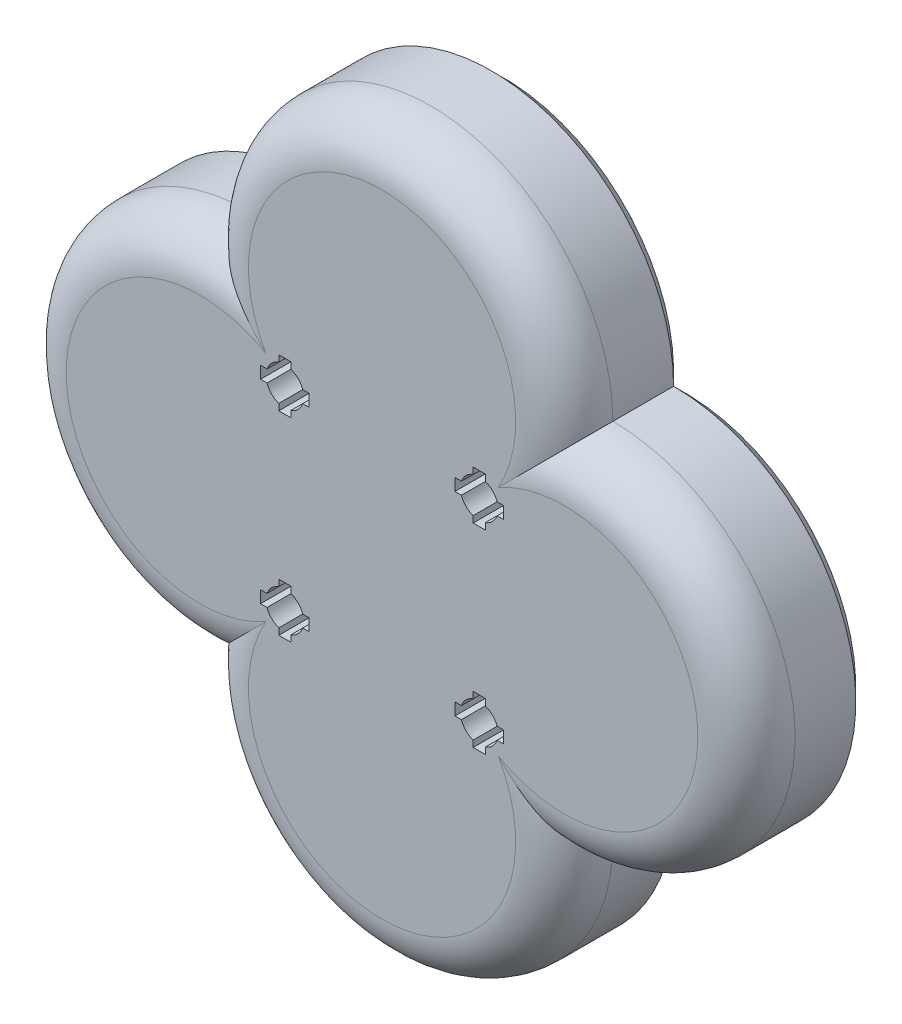
from build123d import *

# Parameters (mm, degrees)
BOSS_EXTRUDE1_DEPTH = 10
FILLET1_R           = 4
CHAMFER1_SIZE       = 1


with BuildPart() as part:
    # Sketch1 → Boss-Extrude1 (new body)
    with BuildSketch(Plane.XY):
        with BuildLine():
            ThreePointArc((-7, 7), (8, 22), (23, 7))
            ThreePointArc((23, 7), (38, -8), (23, -23))
            ThreePointArc((23, -23), (8, -38), (-7, -23))
            ThreePointArc((-7, -23), (-22, -8), (-7, 7))
        make_face()
        with BuildLine():
            Line((-0.5, -2), (0.5, -2))
            Line((0.5, -2), (0.5, -1.467140075))
            ThreePointArc((0.5, -1.467140075), (1.096015511, -1.096015511), (1.467140075, -0.5))
            Line((1.467140075, -0.5), (2, -0.5))
            Line((2, -0.5), (2, 0.5))
            Line((2, 0.5), (1.467140075, 0.5))
            ThreePointArc((1.467140075, 0.5), (1.096015511, 1.096015511), (0.5, 1.467140075))
            Line((0.5, 1.467140075), (0.5, 2))
            Line((0.5, 2), (-0.5, 2))
            Line((-0.5, 2), (-0.5, 1.467140075))
            ThreePointArc((-0.5, 1.467140075), (-1.096015511, 1.096015511), (-1.467140075, 0.5))
            Line((-1.467140075, 0.5), (-2, 0.5))
            Line((-2, 0.5), (-2, -0.5))
            Line((-2, -0.5), (-1.467140075, -0.5))
            ThreePointArc((-1.467140075, -0.5), (-1.096015511, -1.096015511), (-0.5, -1.467140075))
            Line((-0.5, -1.467140075), (-0.5, -2))
        make_face(mode=Mode.SUBTRACT)
        with BuildLine():
            Line((18, -0.5), (18, 0.5))
            Line((18, 0.5), (17.467140075, 0.5))
            ThreePointArc((17.467140075, 0.5), (17.096015511, 1.096015511), (16.5, 1.467140075))
            Line((16.5, 1.467140075), (16.5, 2))
            Line((16.5, 2), (15.5, 2))
            Line((15.5, 2), (15.5, 1.467140075))
            ThreePointArc((15.5, 1.467140075), (14.903984489, 1.096015511), (14.532859925, 0.5))
            Line((14.532859925, 0.5), (14, 0.5))
            Line((14, 0.5), (14, -0.5))
            Line((14, -0.5), (14.532859925, -0.5))
            ThreePointArc((14.532859925, -0.5), (14.903984489, -1.096015511), (15.5, -1.467140075))
            Line((15.5, -1.467140075), (15.5, -2))
            Line((15.5, -2), (16.5, -2))
            Line((16.5, -2), (16.5, -1.467140075))
            ThreePointArc((16.5, -1.467140075), (17.096015511, -1.096015511), (17.467140075, -0.5))
            Line((17.467140075, -0.5), (18, -0.5))
        make_face(mode=Mode.SUBTRACT)
        with BuildLine():
            Line((18, -15.5), (17.467140075, -15.5))
            ThreePointArc((17.467140075, -15.5), (17.096015511, -14.903984489), (16.5, -14.532859925))
            Line((16.5, -14.532859925), (16.5, -14))
            Line((16.5, -14), (15.5, -14))
            Line((15.5, -14), (15.5, -14.532859925))
            ThreePointArc((15.5, -14.532859925), (14.903984489, -14.903984489), (14.532859925, -15.5))
            Line((14.532859925, -15.5), (14, -15.5))
            Line((14, -15.5), (14, -16.5))
            Line((14, -16.5), (14.532859925, -16.5))
            ThreePointArc((14.532859925, -16.5), (14.903984489, -17.096015511), (15.5, -17.467140075))
            Line((15.5, -17.467140075), (15.5, -18))
            Line((15.5, -18), (16.5, -18))
            Line((16.5, -18), (16.5, -17.467140075))
            ThreePointArc((16.5, -17.467140075), (17.096015511, -17.096015511), (17.467140075, -16.5))
            Line((17.467140075, -16.5), (18, -16.5))
            Line((18, -16.5), (18, -15.5))
        make_face(mode=Mode.SUBTRACT)
        with BuildLine():
            Line((-2, -15.5), (-2, -16.5))
            Line((-2, -16.5), (-1.467140075, -16.5))
            ThreePointArc((-1.467140075, -16.5), (-1.096015511, -17.096015511), (-0.5, -17.467140075))
            Line((-0.5, -17.467140075), (-0.5, -18))
            Line((-0.5, -18), (0.5, -18))
            Line((0.5, -18), (0.5, -17.467140075))
            ThreePointArc((0.5, -17.467140075), (1.096015511, -17.096015511), (1.467140075, -16.5))
            Line((1.467140075, -16.5), (2, -16.5))
            Line((2, -16.5), (2, -15.5))
            Line((2, -15.5), (1.467140075, -15.5))
            ThreePointArc((1.467140075, -15.5), (1.096015511, -14.903984489), (0.5, -14.532859925))
            Line((0.5, -14.532859925), (0.5, -14))
            Line((0.5, -14), (-0.5, -14))
            Line((-0.5, -14), (-0.5, -14.532859925))
            ThreePointArc((-0.5, -14.532859925), (-1.096015511, -14.903984489), (-1.467140075, -15.5))
            Line((-1.467140075, -15.5), (-2, -15.5))
        make_face(mode=Mode.SUBTRACT)
    extrude(amount=BOSS_EXTRUDE1_DEPTH)

    # Fillet1
    fillet1_edges = [part.edges().sort_by_distance(p)[0] for p in [
        (-22, -8, 10),
        (8, -38, 10),
        (38, -8, 10),
        (8, 22, 10),
    ]]
    fillet(fillet1_edges, radius=FILLET1_R)

    # Chamfer1
    chamfer1_edges = [part.edges().sort_by_distance(p)[0] for p in [
        (38, -8, 0),
        (8, -38, 0),
        (-22, -8, 0),
        (8, 22, 0),
    ]]
    chamfer(chamfer1_edges, length=CHAMFER1_SIZE)


solid = part.part
